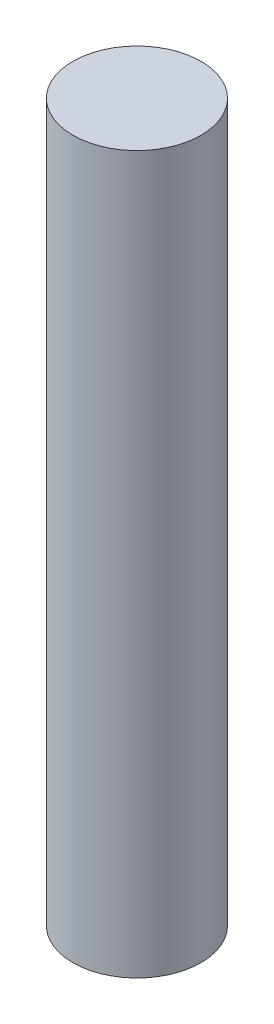
from build123d import *

# Parameters (mm, degrees)
SKETCH_2_R      = 29.5
EXTRUDE_1_DEPTH = 330


with BuildPart() as part:
    # 草图2 → 凸台-拉伸1 (new body)
    with BuildSketch(Plane(origin=(0, 312.00187691, 0), x_dir=(-0.7675667180166875, 0, 0.6409690580621589), z_dir=(0, 1, 0))):
        with Locations(Location((0, 0, 0), (0, 0, 50.135882271))):
            Circle(SKETCH_2_R)
    extrude(amount=EXTRUDE_1_DEPTH)


solid = part.part
